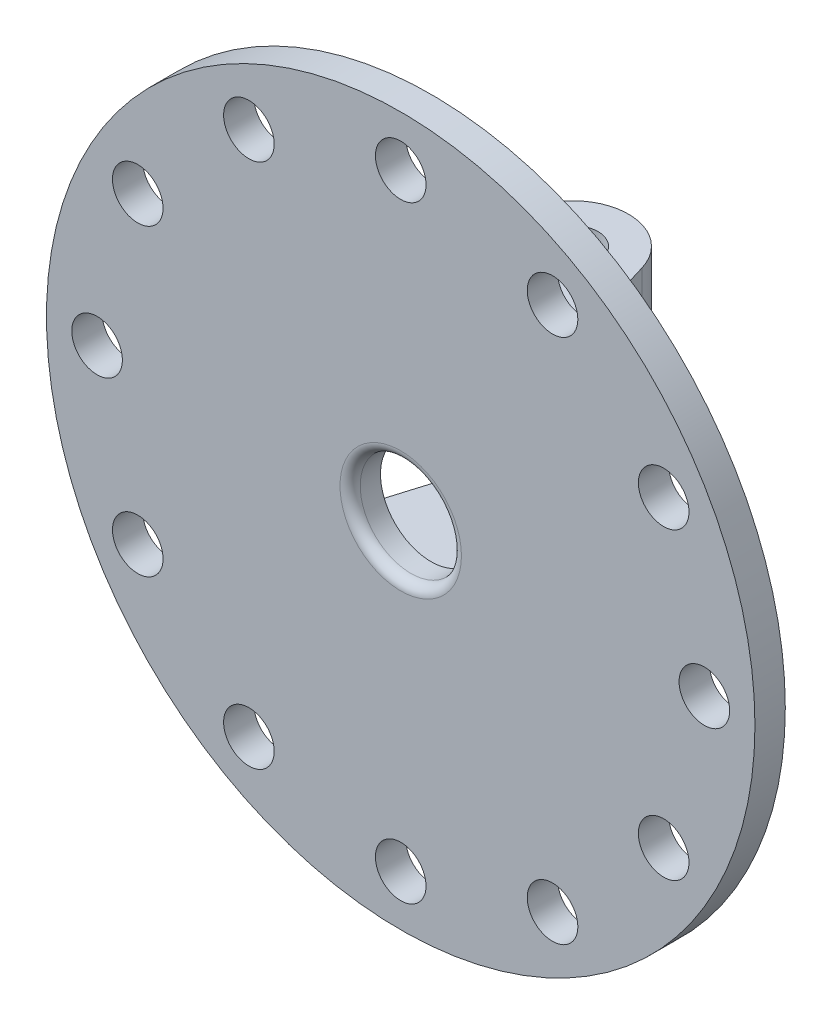
from build123d import *

# Parameters (mm, degrees)
SKETCH_3_R          = 2.5
EXTRUDE_1_DEPTH     = 15
SKETCH_4_W          = 25
SKETCH_4_H          = 12
CUT_EXTRUDE_1_DEPTH = 15
SKETCH_1_R          = 35
SKETCH_1_R_2        = 5
SKETCH_1_R_3        = 2.5
EXTRUDE_2_DEPTH     = 3
FILLET_1_R          = 1


with BuildPart() as part:
    # 스케치3 → 보스-돌출1 (new, symmetric)
    with BuildSketch(Plane(origin=(0, 0, 0), x_dir=(1, 0, 0), z_dir=(0, 1, 0))):
        with BuildLine():
            Line((-10, 0), (10, 0))
            Line((10, 0), (5.262640911, 15.598314937))
            ThreePointArc((5.262640911, 15.598314937), (0, 19.5), (-5.262640911, 15.598314937))
            Line((-5.262640911, 15.598314937), (-10, 0))
        make_face()
        with Locations(Location((0, 14, 0), (0, 0, 270))):
            Circle(SKETCH_3_R, mode=Mode.SUBTRACT)
    extrude(amount=EXTRUDE_1_DEPTH, both=True)

    # 스케치4 → 컷-돌출1 (cut, symmetric)
    with BuildSketch(Plane(origin=(0, 0, 0), x_dir=(0, 0, -1), z_dir=(1, 0, 0))):
        with Locations((12.5, 0)):
            Rectangle(SKETCH_4_W, SKETCH_4_H)
    extrude(amount=CUT_EXTRUDE_1_DEPTH, both=True, mode=Mode.SUBTRACT)


with BuildPart() as cut_extrude_1_piece_1:
    # of the separate pieces the step leaves, piece 1, a body of its own (cut_extrude_1_pieces)
    add(part.part.solids().sort_by_distance((-10, -6, 0))[0])



with BuildPart() as cut_extrude_1_piece_2:
    # of the separate pieces the step leaves, piece 2, a body of its own (cut_extrude_1_pieces)
    add(part.part.solids().sort_by_distance((-10, 15, 0))[0])


with BuildPart() as cut_extrude_1_piece_1_1:
    add(cut_extrude_1_piece_1.part)

    add(cut_extrude_1_piece_2.part)  # 보스-돌출2 merges 컷-돌출1 piece 2
    # 스케치1 → 보스-돌출2 (add)
    with BuildSketch(Plane.XY):
        Circle(SKETCH_1_R)
        Circle(SKETCH_1_R_2, mode=Mode.SUBTRACT)
        with Locations((0, 30)):
            Circle(SKETCH_1_R_3, mode=Mode.SUBTRACT)
        with Locations((15, 25.980762114)):
            Circle(SKETCH_1_R_3, mode=Mode.SUBTRACT)
        with Locations((25.980762114, 15)):
            Circle(SKETCH_1_R_3, mode=Mode.SUBTRACT)
        with Locations((30, 0)):
            Circle(SKETCH_1_R_3, mode=Mode.SUBTRACT)
        with Locations((25.980762114, -15)):
            Circle(SKETCH_1_R_3, mode=Mode.SUBTRACT)
        with Locations((15, -25.980762114)):
            Circle(SKETCH_1_R_3, mode=Mode.SUBTRACT)
        with Locations((0, -30)):
            Circle(SKETCH_1_R_3, mode=Mode.SUBTRACT)
        with Locations((-15, -25.980762114)):
            Circle(SKETCH_1_R_3, mode=Mode.SUBTRACT)
        with Locations((-25.980762114, -15)):
            Circle(SKETCH_1_R_3, mode=Mode.SUBTRACT)
        with Locations((-30, 0)):
            Circle(SKETCH_1_R_3, mode=Mode.SUBTRACT)
        with Locations((-25.980762114, 15)):
            Circle(SKETCH_1_R_3, mode=Mode.SUBTRACT)
        with Locations((-15, 25.980762114)):
            Circle(SKETCH_1_R_3, mode=Mode.SUBTRACT)
    extrude(amount=EXTRUDE_2_DEPTH)

    # 필렛1
    fillet_1_edges = [cut_extrude_1_piece_1_1.edges().sort_by_distance(p)[0] for p in [
        (-5, 0, 3),
    ]]
    fillet(fillet_1_edges, radius=FILLET_1_R)


solid = cut_extrude_1_piece_1_1.part
